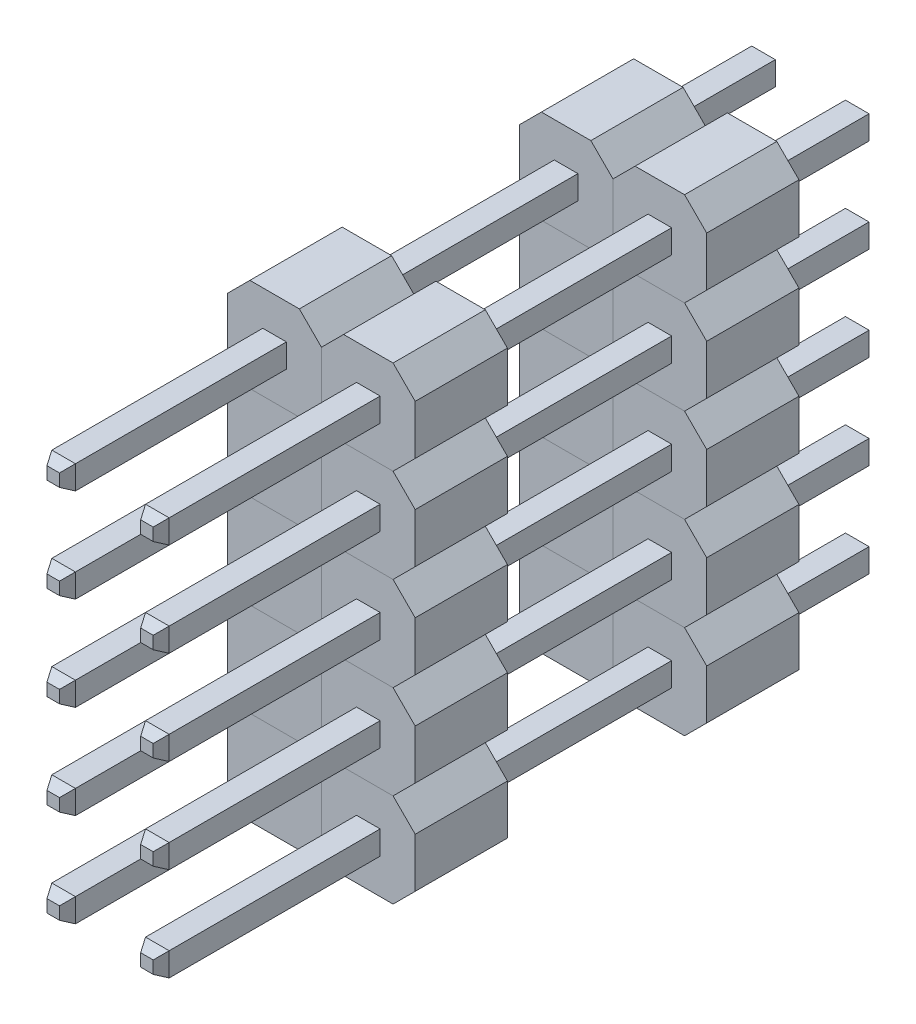
from build123d import *
from OCP.BRepFilletAPI import BRepFilletAPI_MakeChamfer

# Parameters (mm, degrees)
SKETCH_1_W               = 2.54
SKETCH_1_H               = 2.54
EXTRUDE_1_DEPTH          = 2.5
SKETCH_3_W               = 2.54
SKETCH_3_H               = 2.54
EXTRUDE_3_DEPTH          = 2.5
CHAMFER_1_SIZE           = 0.6
CHAMFER_3_SIZE           = 0.6
EXTRUDE_START            = -16.4
SKETCH_2_W               = 0.64
SKETCH_2_H               = 0.64
EXTRUDE_2_DEPTH          = 19.4
CHAMFER_2_SIZE           = 0.15
CHAMFER_2_SIZE2          = 0.28210897
PATTERN_LINEAR_5_COUNT   = 2
PATTERN_LINEAR_5_PITCH   = 2.54
PATTERN_LINEAR_5_2_COUNT = 5
PATTERN_LINEAR_5_2_PITCH = 2.54


with BuildPart() as part:
    # Эскиз1 → Бобышка-Вытянуть1 (new body)
    with BuildSketch(Plane.XY):
        with Locations((-1.27, -5.08)):
            Rectangle(SKETCH_1_W, SKETCH_1_H)
    extrude(amount=EXTRUDE_1_DEPTH)

    # Фаска1
    chamfer_1_edges = [part.edges().sort_by_distance(p)[0] for p in [
        (0, -6.35, 1.25),
        (-2.54, -6.35, 1.25),
        (-2.54, -3.81, 1.25),
        (0, -3.81, 1.25),
    ]]
    chamfer(chamfer_1_edges, length=CHAMFER_1_SIZE)

    # Эскиз2 → Бобышка-Вытянуть2 (add)
    with BuildSketch(Plane(origin=(0, 0, 0), x_dir=(-1, 0, 0), z_dir=(0, 0, -1)).offset(EXTRUDE_START)):
        with Locations((1.27, -5.08)):
            Rectangle(SKETCH_2_W, SKETCH_2_H)
    extrude(amount=EXTRUDE_2_DEPTH)

    # Фаска2: one chamfer whose edges measure the first distance from different faces: ONE call of the kernel's chamfer builder (chamfer() names one face for all edges)
    chamfer_2_edges_1 = [part.edges().sort_by_distance(p)[0] for p in [
        (-0.95, -5.08, 16.4),
        (-1.27, -4.76, 16.4),
        (-1.59, -5.08, 16.4),
        (-1.27, -5.4, 16.4),
    ]]
    chamfer_2_side_1 = [part.faces().sort_by_distance(p)[0] for p in [
        (-1.27, -5.08, 16.4),
    ]]
    chamfer_2_edges_2 = [part.edges().sort_by_distance(p)[0] for p in [
        (-0.95, -5.08, -3),
    ]]
    chamfer_2_side_2 = [part.faces().sort_by_distance(p)[0] for p in [
        (-0.95, -5.08, -1.5),
    ]]
    chamfer_2_edges_3 = [part.edges().sort_by_distance(p)[0] for p in [
        (-1.27, -5.4, -3),
    ]]
    chamfer_2_side_3 = [part.faces().sort_by_distance(p)[0] for p in [
        (-1.27, -5.4, -1.5),
    ]]
    chamfer_2_edges_4 = [part.edges().sort_by_distance(p)[0] for p in [
        (-1.59, -5.08, -3),
    ]]
    chamfer_2_side_4 = [part.faces().sort_by_distance(p)[0] for p in [
        (-1.59, -5.08, -1.5),
    ]]
    chamfer_2_edges_5 = [part.edges().sort_by_distance(p)[0] for p in [
        (-1.27, -4.76, -3),
    ]]
    chamfer_2_side_5 = [part.faces().sort_by_distance(p)[0] for p in [
        (-1.27, -4.76, -1.5),
    ]]
    chamfer_2 = BRepFilletAPI_MakeChamfer(part.part.solid().wrapped)
    for e in chamfer_2_edges_1:
        chamfer_2.Add(CHAMFER_2_SIZE, CHAMFER_2_SIZE2, e.wrapped, chamfer_2_side_1[0].wrapped)  # the first distance lies on this face
    for e in chamfer_2_edges_2:
        chamfer_2.Add(CHAMFER_2_SIZE, CHAMFER_2_SIZE2, e.wrapped, chamfer_2_side_2[0].wrapped)  # the first distance lies on this face
    for e in chamfer_2_edges_3:
        chamfer_2.Add(CHAMFER_2_SIZE, CHAMFER_2_SIZE2, e.wrapped, chamfer_2_side_3[0].wrapped)  # the first distance lies on this face
    for e in chamfer_2_edges_4:
        chamfer_2.Add(CHAMFER_2_SIZE, CHAMFER_2_SIZE2, e.wrapped, chamfer_2_side_4[0].wrapped)  # the first distance lies on this face
    for e in chamfer_2_edges_5:
        chamfer_2.Add(CHAMFER_2_SIZE, CHAMFER_2_SIZE2, e.wrapped, chamfer_2_side_5[0].wrapped)  # the first distance lies on this face
    add(Compound.cast(chamfer_2.Shape()), mode=Mode.REPLACE)


with BuildPart() as body_2:
    # Эскиз3 → Бобышка-Вытянуть3 (new body)
    with BuildSketch(Plane.XY.offset(10.4)):
        with Locations((-1.27, -5.08)):
            Rectangle(SKETCH_3_W, SKETCH_3_H)
    extrude(amount=-EXTRUDE_3_DEPTH)

    # Фаска3
    chamfer_3_edges = [body_2.edges().sort_by_distance(p)[0] for p in [
        (0, -6.35, 9.15),
        (-2.54, -6.35, 9.15),
        (-2.54, -3.81, 9.15),
        (0, -3.81, 9.15),
    ]]
    chamfer(chamfer_3_edges, length=CHAMFER_3_SIZE)


with BuildPart() as pattern_linear_5_1:
    # Линейный массив5: pattern copy
    add(body_2.part.moved(Location(Vector(1, 0, 0) * (1 * PATTERN_LINEAR_5_PITCH))))


with BuildPart() as pattern_linear_5_2:
    # Линейный массив5: pattern copy
    add(part.part.moved(Location(Vector(1, 0, 0) * (1 * PATTERN_LINEAR_5_PITCH))))


with BuildPart() as pattern_linear_5_2_1:
    # Pattern Linear 5 2: pattern copy
    add(body_2.part.moved(Location(Vector(0, 1, 0) * (1 * PATTERN_LINEAR_5_2_PITCH))))


with BuildPart() as pattern_linear_5_2_2:
    # Pattern Linear 5 2: pattern copy
    add(body_2.part.moved(Location(Vector(0, 1, 0) * (2 * PATTERN_LINEAR_5_2_PITCH))))


with BuildPart() as pattern_linear_5_2_3:
    # Pattern Linear 5 2: pattern copy
    add(body_2.part.moved(Location(Vector(0, 1, 0) * (3 * PATTERN_LINEAR_5_2_PITCH))))


with BuildPart() as pattern_linear_5_2_4:
    # Pattern Linear 5 2: pattern copy
    add(body_2.part.moved(Location(Vector(0, 1, 0) * (4 * PATTERN_LINEAR_5_2_PITCH))))


with BuildPart() as pattern_linear_5_2_5:
    # Pattern Linear 5 2: pattern copy
    add(part.part.moved(Location(Vector(0, 1, 0) * (1 * PATTERN_LINEAR_5_2_PITCH))))


with BuildPart() as pattern_linear_5_2_6:
    # Pattern Linear 5 2: pattern copy
    add(part.part.moved(Location(Vector(0, 1, 0) * (2 * PATTERN_LINEAR_5_2_PITCH))))


with BuildPart() as pattern_linear_5_2_7:
    # Pattern Linear 5 2: pattern copy
    add(part.part.moved(Location(Vector(0, 1, 0) * (3 * PATTERN_LINEAR_5_2_PITCH))))


with BuildPart() as pattern_linear_5_2_8:
    # Pattern Linear 5 2: pattern copy
    add(part.part.moved(Location(Vector(0, 1, 0) * (4 * PATTERN_LINEAR_5_2_PITCH))))


with BuildPart() as pattern_linear_5_2_9:
    # Pattern Linear 5 2: pattern copy
    add(pattern_linear_5_1.part.moved(Location(Vector(0, 1, 0) * (1 * PATTERN_LINEAR_5_2_PITCH))))


with BuildPart() as pattern_linear_5_2_10:
    # Pattern Linear 5 2: pattern copy
    add(pattern_linear_5_1.part.moved(Location(Vector(0, 1, 0) * (2 * PATTERN_LINEAR_5_2_PITCH))))


with BuildPart() as pattern_linear_5_2_11:
    # Pattern Linear 5 2: pattern copy
    add(pattern_linear_5_1.part.moved(Location(Vector(0, 1, 0) * (3 * PATTERN_LINEAR_5_2_PITCH))))


with BuildPart() as pattern_linear_5_2_12:
    # Pattern Linear 5 2: pattern copy
    add(pattern_linear_5_1.part.moved(Location(Vector(0, 1, 0) * (4 * PATTERN_LINEAR_5_2_PITCH))))


with BuildPart() as pattern_linear_5_2_13:
    # Pattern Linear 5 2: pattern copy
    add(pattern_linear_5_2.part.moved(Location(Vector(0, 1, 0) * (1 * PATTERN_LINEAR_5_2_PITCH))))


with BuildPart() as pattern_linear_5_2_14:
    # Pattern Linear 5 2: pattern copy
    add(pattern_linear_5_2.part.moved(Location(Vector(0, 1, 0) * (2 * PATTERN_LINEAR_5_2_PITCH))))


with BuildPart() as pattern_linear_5_2_15:
    # Pattern Linear 5 2: pattern copy
    add(pattern_linear_5_2.part.moved(Location(Vector(0, 1, 0) * (3 * PATTERN_LINEAR_5_2_PITCH))))


with BuildPart() as pattern_linear_5_2_16:
    # Pattern Linear 5 2: pattern copy
    add(pattern_linear_5_2.part.moved(Location(Vector(0, 1, 0) * (4 * PATTERN_LINEAR_5_2_PITCH))))


solid = Compound([part.part, body_2.part, pattern_linear_5_1.part, pattern_linear_5_2.part, pattern_linear_5_2_1.part, pattern_linear_5_2_2.part, pattern_linear_5_2_3.part, pattern_linear_5_2_4.part, pattern_linear_5_2_5.part, pattern_linear_5_2_6.part, pattern_linear_5_2_7.part, pattern_linear_5_2_8.part, pattern_linear_5_2_9.part, pattern_linear_5_2_10.part, pattern_linear_5_2_11.part, pattern_linear_5_2_12.part, pattern_linear_5_2_13.part, pattern_linear_5_2_14.part, pattern_linear_5_2_15.part, pattern_linear_5_2_16.part])
